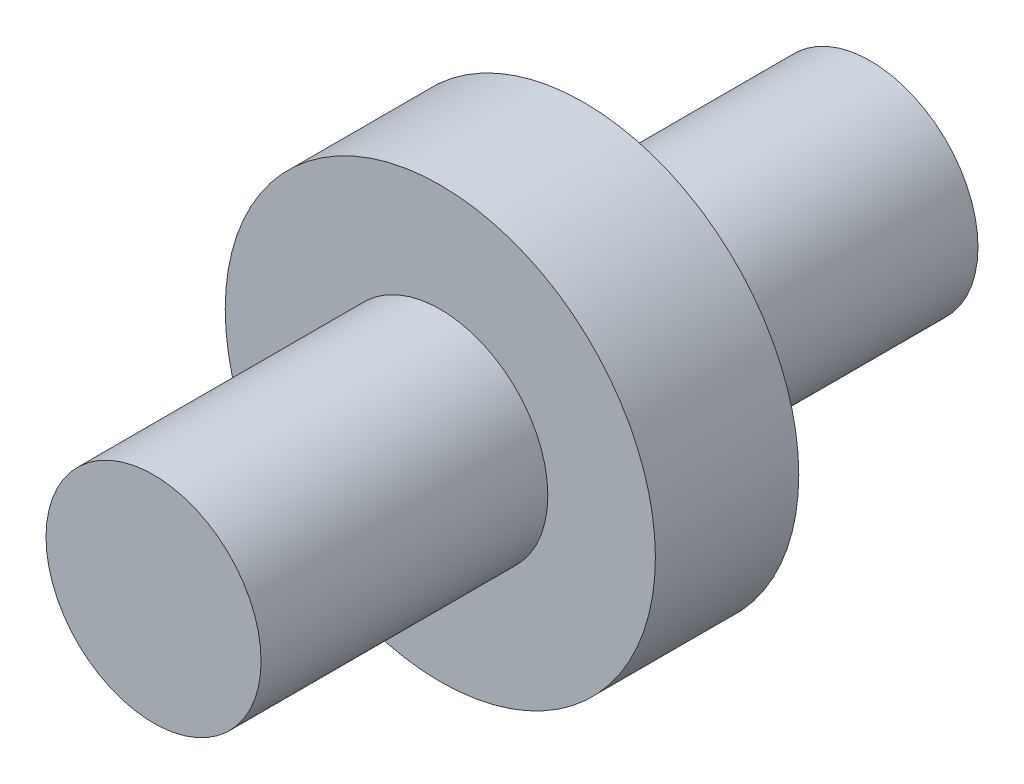
from build123d import *

# Parameters (mm, degrees)
SKETCH1_R           = 9.525
BOSS_EXTRUDE1_DEPTH = 25.4
SKETCH3_R           = 19.05
BOSS_EXTRUDE3_DEPTH = 12.7
SKETCH4_R           = 9.525
BOSS_EXTRUDE4_DEPTH = 25.4


with BuildPart() as part:
    # Sketch1 → Boss-Extrude1 (new body)
    with BuildSketch(Plane.XY):
        Circle(SKETCH1_R)
    extrude(amount=BOSS_EXTRUDE1_DEPTH)

    # Sketch3 → Boss-Extrude3 (add)
    with BuildSketch(Plane.XY.offset(25.4)):
        Circle(SKETCH3_R)
    extrude(amount=BOSS_EXTRUDE3_DEPTH)

    # Sketch4 → Boss-Extrude4 (add)
    with BuildSketch(Plane.XY.offset(38.1)):
        Circle(SKETCH4_R)
    extrude(amount=BOSS_EXTRUDE4_DEPTH)


solid = part.part
